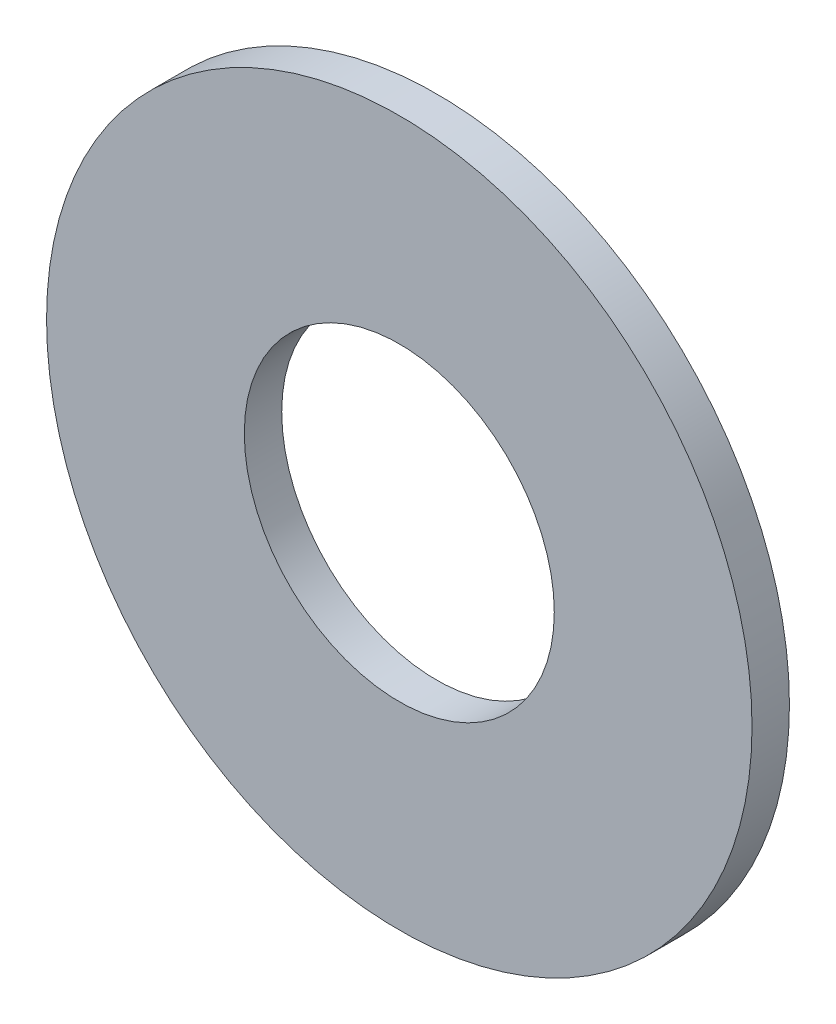
from build123d import *

# Parameters (mm, degrees)
SKETCH_1_R      = 33
SKETCH_1_R_2    = 14.5
EXTRUDE_1_DEPTH = 1.75


with BuildPart() as part:
    # 草图1 → 凸台-拉伸1 (new, symmetric)
    with BuildSketch(Plane.XY):
        Circle(SKETCH_1_R)
        Circle(SKETCH_1_R_2, mode=Mode.SUBTRACT)
    extrude(amount=EXTRUDE_1_DEPTH, both=True)


solid = part.part
